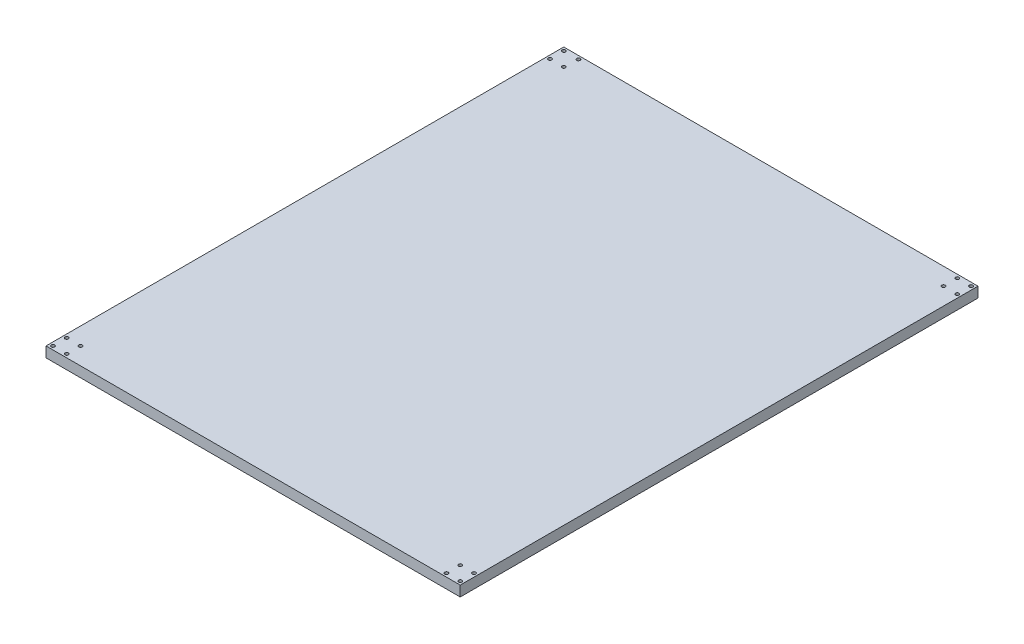
from build123d import *

# Parameters (mm, degrees)
SKETCH1_W                 = 600
SKETCH1_H                 = 750
BOSS_EXTRUDE1_DEPTH       = 15
F_5_0MM_DOWEL_HOLE1_D     = 5
F_5_0MM_DOWEL_HOLE1_DEPTH = 30
F_5_0MM_DOWEL_HOLE1_TIP   = 1.502151548
F_5_0MM_DOWEL_HOLE2_D     = 5


with BuildPart() as part:
    # Sketch1 → Boss-Extrude1 (new body)
    with BuildSketch(Plane(origin=(0, 0, 0), x_dir=(1, 0, 0), z_dir=(0, 1, 0))):
        with Locations((-4429.023254343, 1982.601020053)):
            Rectangle(SKETCH1_W, SKETCH1_H)
    extrude(amount=BOSS_EXTRUDE1_DEPTH)

    # Ø5.0mm Dowel Hole1
    with Locations(Plane(origin=(0, 15, 0), x_dir=(1, 0, 0), z_dir=(0, 1, 0))):
        with Locations((-4134.023254343, 1632.601020053), (-4154.023254343, 1632.601020053), (-4154.023254343, 1612.601020053), (-4134.023254343, 1612.601020053)):
            Hole(F_5_0MM_DOWEL_HOLE1_D / 2, depth=F_5_0MM_DOWEL_HOLE1_DEPTH)
            with Locations((0, 0, -(F_5_0MM_DOWEL_HOLE1_DEPTH + F_5_0MM_DOWEL_HOLE1_TIP / 2))):  # 118° drill point
                Cone(0, F_5_0MM_DOWEL_HOLE1_D / 2, F_5_0MM_DOWEL_HOLE1_TIP, mode=Mode.SUBTRACT)

    # Ø5.0mm Dowel Hole2 (through all)
    with Locations(Plane(origin=(-4724.023254343, 15, -2352.601020053), x_dir=(0, 0, 1), z_dir=(0, 1, 0))):
        with Locations((0, 0), (0, 21.213554644), (20, 0), (20, 20), (0, 590), (0, 570), (20, 570), (20, 590), (720, 20), (740, 20), (740, 0), (720, 0)):
            Hole(F_5_0MM_DOWEL_HOLE2_D / 2)


solid = part.part
